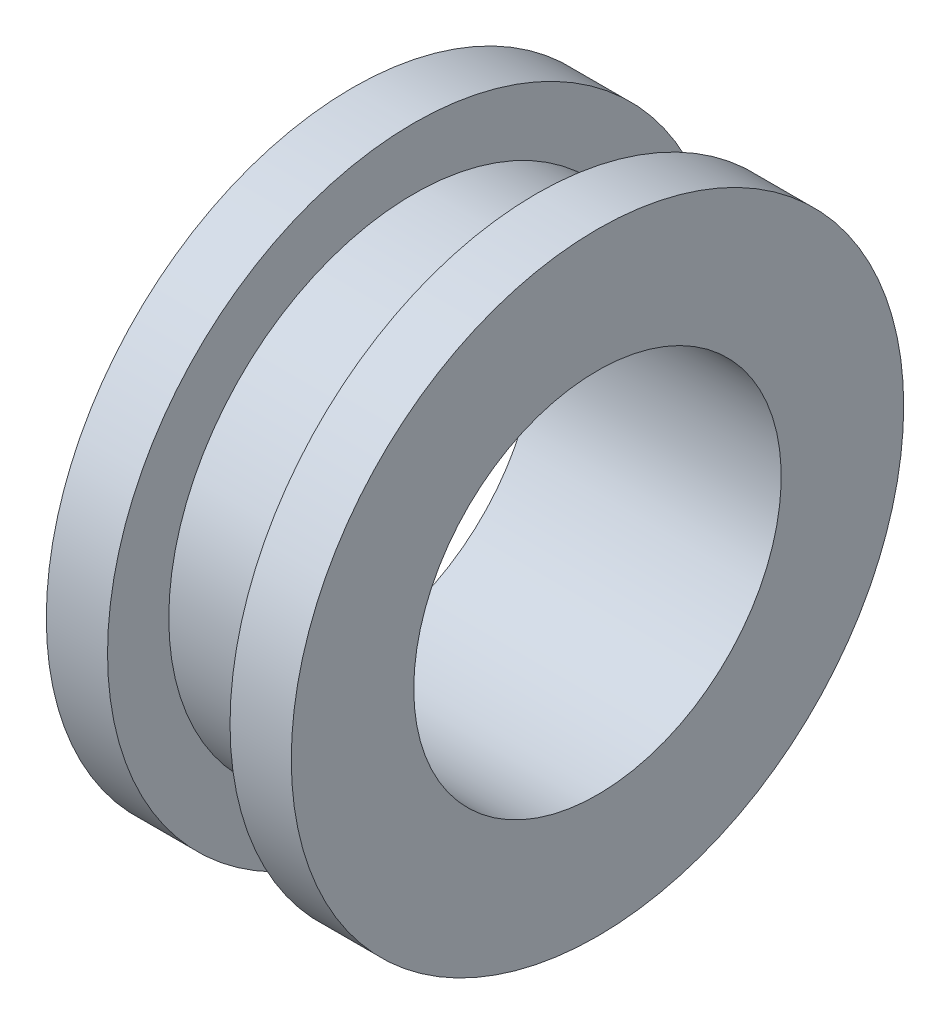
from build123d import *


with BuildPart() as part:
    # ｽｹｯﾁ1 → 回転1 (revolve)
    with BuildSketch(Plane.XY, mode=Mode.PRIVATE) as revolve_1_sk:
        Polygon((4.5, 7.5), (6, 7.5), (6, 4.5), (0, 4.5), (0, 7.5), (1.5, 7.5), (1.5, 6), (4.5, 6), align=None)
    revolve(revolve_1_sk.sketch.rotate(Axis((0, 0, 0), (1, 0, 0)), 90), axis=Axis((0, 0, 0), (1, 0, 0)))


solid = part.part
